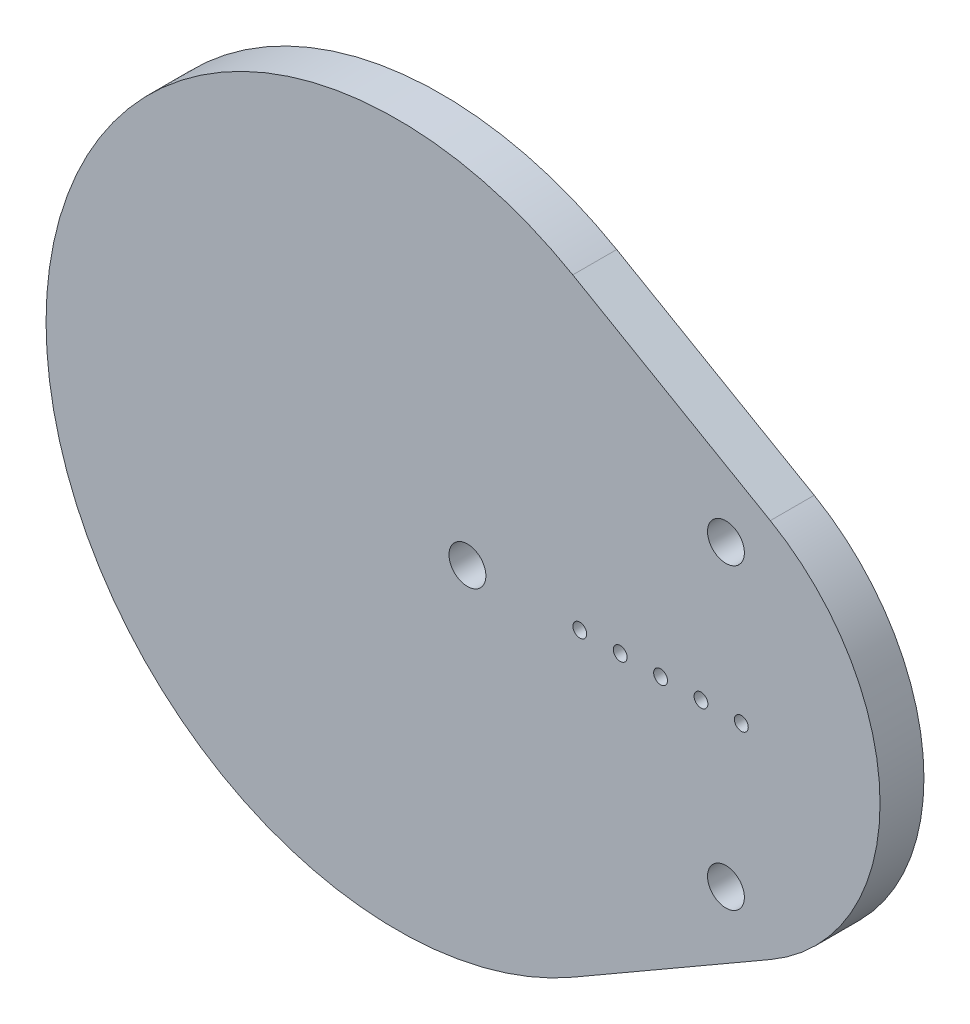
from build123d import *

# Parameters (mm, degrees)
SKETCH1_R           = 2.665
SKETCH1_R_2         = 1
BOSS_EXTRUDE1_DEPTH = 6.35


with BuildPart() as part:
    # Sketch1 → Boss-Extrude1 (new body)
    with BuildSketch(Plane.XY):
        with BuildLine():
            Line((-12.7, -43.994090512), (15.875, -27.49630657))
            ThreePointArc((15.875, -27.49630657), (31.75, 0), (15.875, 27.49630657))
            Line((15.875, 27.49630657), (-12.7, 43.994090512))
            ThreePointArc((-12.7, 43.994090512), (-88.9, 0), (-12.7, -43.994090512))
        make_face()
        with Locations((9.454976935, 21.59)):
            Circle(SKETCH1_R, mode=Mode.SUBTRACT)
        with Locations((-27.94, 0)):
            Circle(SKETCH1_R, mode=Mode.SUBTRACT)
        with Locations((-11.684, 0)):
            Circle(SKETCH1_R_2, mode=Mode.SUBTRACT)
        with Locations((-5.842, 0)):
            Circle(SKETCH1_R_2, mode=Mode.SUBTRACT)
        Circle(SKETCH1_R_2, mode=Mode.SUBTRACT)
        with Locations((9.454976935, -21.59)):
            Circle(SKETCH1_R, mode=Mode.SUBTRACT)
        with Locations((5.842, 0)):
            Circle(SKETCH1_R_2, mode=Mode.SUBTRACT)
        with Locations((11.684, 0)):
            Circle(SKETCH1_R_2, mode=Mode.SUBTRACT)
    extrude(amount=BOSS_EXTRUDE1_DEPTH)


solid = part.part
